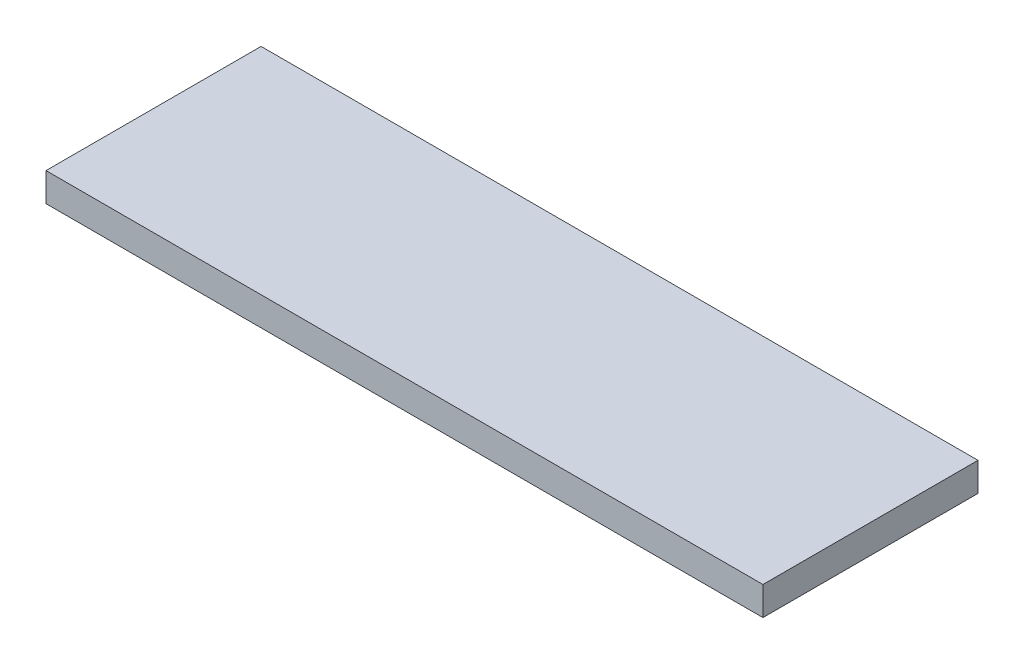
from build123d import *

# Parameters (mm, degrees)
SKETCH1_W           = 50
SKETCH1_H           = 15
BOSS_EXTRUDE1_DEPTH = 2


with BuildPart() as part:
    # Sketch1 → Boss-Extrude1 (new body)
    with BuildSketch(Plane(origin=(0, 0, 0), x_dir=(1, 0, 0), z_dir=(0, 1, 0))):
        with Locations((25, 7.5)):
            Rectangle(SKETCH1_W, SKETCH1_H)
    extrude(amount=BOSS_EXTRUDE1_DEPTH)


solid = part.part
